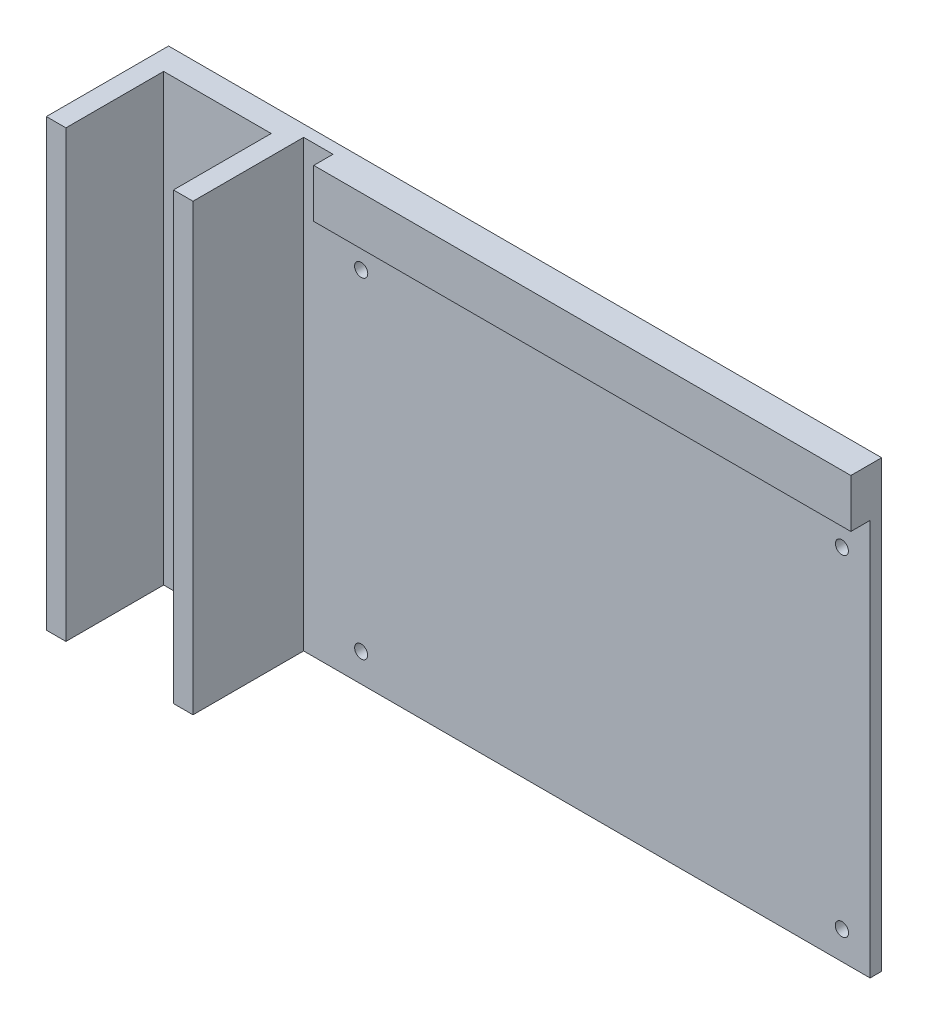
from build123d import *

# Parameters (mm, degrees)
SKETCH2_W           = 139.548362388
SKETCH2_H           = 106.68
SKETCH2_R           = 1.694422917
SKETCH2_R_2         = 1.72646965
SKETCH2_R_3         = 1.691560161
SKETCH2_R_4         = 1.711798923
BOSS_EXTRUDE1_DEPTH = 3
SKETCH3_W           = 139.548362388
SKETCH3_H           = 3.711398725
BOSS_EXTRUDE3_DEPTH = 5
SKETCH5_W           = 139.548362388
SKETCH5_H           = 8
BOSS_EXTRUDE4_DEPTH = 8.89
SKETCH11_W          = 7.62
SKETCH11_H          = 115.57
BOSS_EXTRUDE6_DEPTH = 3
SKETCH12_W          = 38.1
SKETCH12_H          = 115.57
BOSS_EXTRUDE7_DEPTH = 31.75
CUT_EXTRUDE5_DEPTH  = 25.4


with BuildPart() as part:
    # Sketch2 → Boss-Extrude1 (new body)
    with BuildSketch(Plane.XY):
        with Locations((0, -0.635)):
            Rectangle(SKETCH2_W, SKETCH2_H)
        with Locations((-62.457904908, -46.615338173)):
            Circle(SKETCH2_R, mode=Mode.SUBTRACT)
        with Locations((62.445492634, -46.647315498)):
            Circle(SKETCH2_R_2, mode=Mode.SUBTRACT)
        with Locations((62.449204631, 39.274150641)):
            Circle(SKETCH2_R_3, mode=Mode.SUBTRACT)
        with Locations((-62.450661347, 39.253558779)):
            Circle(SKETCH2_R_4, mode=Mode.SUBTRACT)
    extrude(amount=BOSS_EXTRUDE1_DEPTH)

    # Sketch3 → Boss-Extrude3 (add)
    with BuildSketch(Plane.XY.offset(3)):
        with Locations((0, 50.849300638)):
            Rectangle(SKETCH3_W, SKETCH3_H)
    extrude(amount=BOSS_EXTRUDE3_DEPTH)

    # Sketch5 → Boss-Extrude4 (add)
    with BuildSketch(Plane(origin=(0, 52.705, 0), x_dir=(1, 0, 0), z_dir=(0, 1, 0))):
        with Locations((0, -4)):
            Rectangle(SKETCH5_W, SKETCH5_H)
    extrude(amount=BOSS_EXTRUDE4_DEPTH)

    # Sketch11 → Boss-Extrude6 (add)
    with BuildSketch(Plane(origin=(0, 0, 0), x_dir=(-1, 0, 0), z_dir=(0, 0, -1))):
        with Locations((73.584181194, 3.81)):
            Rectangle(SKETCH11_W, SKETCH11_H)
    extrude(amount=-BOSS_EXTRUDE6_DEPTH)

    # Sketch12 → Boss-Extrude7 (add)
    with BuildSketch(Plane(origin=(0, 0, 0), x_dir=(-1, 0, 0), z_dir=(0, 0, -1))):
        with Locations((96.444181194, 3.81)):
            Rectangle(SKETCH12_W, SKETCH12_H)
    extrude(amount=-BOSS_EXTRUDE7_DEPTH)

    # Sketch13 → Cut-Extrude5 (cut)
    with BuildSketch(Plane.XY.offset(31.75)):
        Polygon((-110.414181194, -48.895), (-110.414181194, -53.975), (-82.474181194, -53.975), (-82.474181194, -48.895), (-82.474181194, 56.515), (-82.474181194, 61.595), (-110.414181194, 61.595), (-110.414181194, 56.515), align=None)
    extrude(amount=-CUT_EXTRUDE5_DEPTH, mode=Mode.SUBTRACT)


solid = part.part
